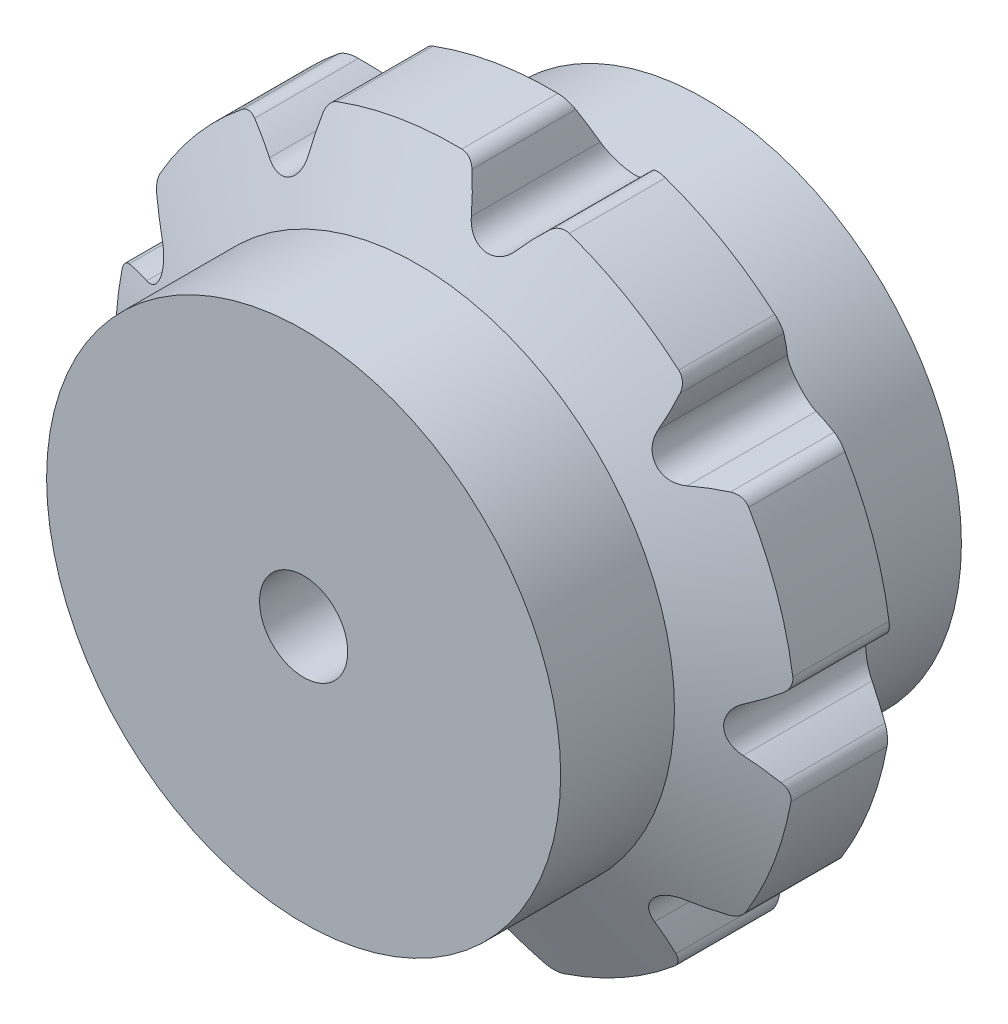
from build123d import *
from build123d.topology import SkipClean

# Parameters (mm, degrees)
CUT_EXTRUDE1_DEPTH  = 40.075672544
CIRPATTERN1_COUNT   = 10
CIRPATTERN1_ANGLE   = 359
SKETCH7_R           = 3
SKETCH7_R_2         = 2.75
BOSS_EXTRUDE1_DEPTH = 25
SKETCH7_2_R         = 3
BOSS_EXTRUDE2_DEPTH = 25
SKETCH7_3_R         = 2.75
CUT_EXTRUDE2_DEPTH  = 40.075672652


with BuildPart() as part:
    # Sketch1 → Revolve1 (revolve)
    with BuildSketch(Plane(origin=(0, 0, 0), x_dir=(1, 0, 0), z_dir=(0, 1, 0))):
        Polygon((3, 12.5), (16.035679701, 12.5), (16.035679701, 5.4), (21.235679701, 3), (21.235679701, -3), (16.035679701, -5.4), (16.035679701, -12.5), (12.035679701, -12.5), (10, -2.5), (3, -2.5), align=None)
    revolve(axis=Axis((0, 0, 0), (0, 0, 1)))

    # Sketch3 → Cut-Extrude1 (cut, through all)
    with BuildSketch(Plane.XY.offset(12.5)):
        with BuildLine():
            ThreePointArc((20.960566803, 3.407158885), (21.235679701, 0), (20.960566803, -3.407158885))
            ThreePointArc((20.960566803, -3.407158885), (20.902304198, -2.87608782), (20.578938361, -2.450804923))
            ThreePointArc((20.578938361, -2.450804923), (19.791680516, -1.89675335), (18.965580661, -1.402479044))
            ThreePointArc((18.965580661, -1.402479044), (18.135679701, 0), (18.965580661, 1.402479044))
            ThreePointArc((18.965580661, 1.402479044), (19.791680516, 1.89675335), (20.578938361, 2.450804923))
            ThreePointArc((20.578938361, 2.450804923), (20.902304198, 2.87608782), (20.960566803, 3.407158885))
        make_face()
    cut_extrude1 = extrude(amount=-CUT_EXTRUDE1_DEPTH, mode=Mode.SUBTRACT)

    # Sketch6 → Revolve5 (revolve)
    with BuildSketch(Plane.ZY):
        Polygon((12.5, 3), (12.5, 12.035679701), (12.5, 16.035679701), (5.4, 16.035679701), (3, 21.235679701), (-3, 21.235679701), (-5.4, 16.035679701), (-12.5, 16.035679701), (-12.5, 3), align=None)
    revolve(axis=Axis((0, 0, -12.5), (0, 0, 1)))

    # CirPattern1: Cut-Extrude1 ×10 about axis
    cirpattern1_axis = Axis((0, 0, -80.9), (0, 0, 1))
    for i in range(1, CIRPATTERN1_COUNT):
        add(cut_extrude1.rotate(cirpattern1_axis, i * CIRPATTERN1_ANGLE / (CIRPATTERN1_COUNT - 1)), mode=Mode.SUBTRACT)

    # Sketch7 → Boss-Extrude1 (add)
    with SkipClean():  # the faces are left unmerged after this step: merging them gives an invalid solid
        with BuildSketch(Plane(origin=(0, 0, -12.5), x_dir=(-1, 0, 0), z_dir=(0, 0, -1))):
            Circle(SKETCH7_R)
            Circle(SKETCH7_R_2, mode=Mode.SUBTRACT)
        extrude(amount=-BOSS_EXTRUDE1_DEPTH)

    # Sketch7<2> → Boss-Extrude2 (add)
    with SkipClean():  # the faces are left unmerged after this step: merging them gives an invalid solid
        with BuildSketch(Plane(origin=(0, 0, -12.5), x_dir=(-1, 0, 0), z_dir=(0, 0, -1))):
            Circle(SKETCH7_2_R)
        extrude(amount=-BOSS_EXTRUDE2_DEPTH)

    # Sketch7<3> → Cut-Extrude2 (cut, through all)
    with SkipClean():  # the faces are left unmerged after this step: merging them gives an invalid solid
        with BuildSketch(Plane(origin=(0, 0, -12.5), x_dir=(-1, 0, 0), z_dir=(0, 0, -1))):
            Circle(SKETCH7_3_R)
        extrude(amount=-CUT_EXTRUDE2_DEPTH, mode=Mode.SUBTRACT)


solid = part.part
